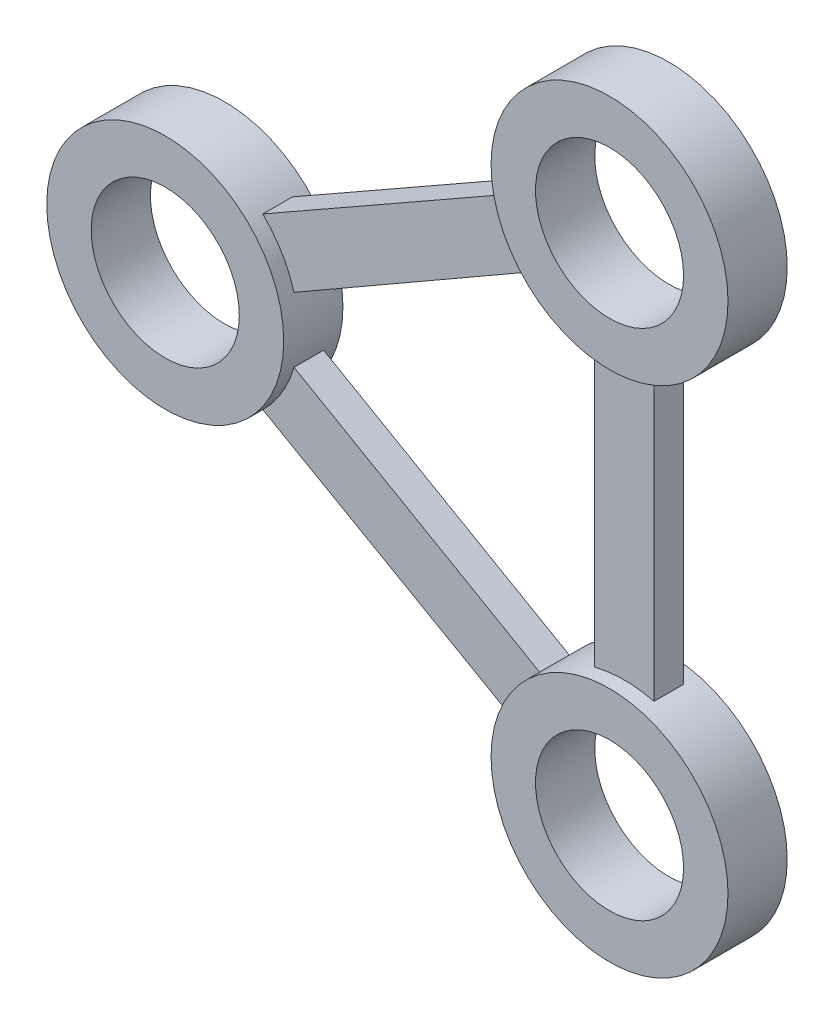
from build123d import *

# Parameters (mm, degrees)
BOSS_EXTRUDE1_DEPTH        = 5
BOSS_EXTRUDE1_DEPTH_BACK   = 5
BOSS_EXTRUDE1_2_DEPTH      = 5
BOSS_EXTRUDE1_2_DEPTH_BACK = 5
BOSS_EXTRUDE1_3_DEPTH      = 5
BOSS_EXTRUDE1_3_DEPTH_BACK = 5
BOSS_EXTRUDE2_DEPTH        = 10
BOSS_EXTRUDE2_DEPTH_BACK   = 10
SKETCH1_6_R                = 40
SKETCH1_6_R_2              = 25


with BuildPart() as part:
    # Sketch1 → Boss-Extrude1 (new, two sides: drawn at the far end of the back side and taken through both)
    with BuildSketch(Plane.XY.offset(-BOSS_EXTRUDE1_DEPTH_BACK)):
        with BuildLine():
            Line((10, 47.870166538), (10, -47.870166538))
            ThreePointArc((10, -47.870166538), (0, -46.6), (-10, -47.870166538))
            Line((-10, -47.870166538), (-10, 47.870166538))
            ThreePointArc((-10, 47.870166538), (0, 46.6), (10, 47.870166538))
        make_face()
    extrude(amount=BOSS_EXTRUDE1_DEPTH + BOSS_EXTRUDE1_DEPTH_BACK)



with BuildPart() as body_2:
    # Sketch1 → Boss-Extrude1 2 (new, two sides: drawn at the far end of the back side and taken through both)
    with BuildSketch(Plane.XY.offset(-BOSS_EXTRUDE1_2_DEPTH_BACK)):
        with BuildLine():
            Line((-122.049730922, 28.614375032), (-38.604515092, 76.126633087))
            ThreePointArc((-38.604515092, 76.126633087), (-34.719424314, 66.736425918), (-28.593413405, 58.628287327))
            Line((-28.593413405, 58.628287327), (-111.528626884, 10.952326263))
            ThreePointArc((-111.528626884, 10.952326263), (-115.635110511, 20.470817531), (-122.049730922, 28.614375032))
        make_face()
    extrude(amount=BOSS_EXTRUDE1_2_DEPTH + BOSS_EXTRUDE1_2_DEPTH_BACK)


with BuildPart() as body_3:
    # Sketch1 → Boss-Extrude1 3 (new, two sides: drawn at the far end of the back side and taken through both)
    with BuildSketch(Plane.XY.offset(-BOSS_EXTRUDE1_3_DEPTH_BACK)):
        with BuildLine():
            Line((-111.528626884, -10.952326263), (-28.593413405, -58.628287327))
            ThreePointArc((-28.593413405, -58.628287327), (-34.719424235, -66.736425963), (-38.604515092, -76.126633087))
            Line((-38.604515092, -76.126633087), (-122.049730922, -28.614375032))
            ThreePointArc((-122.049730922, -28.614375032), (-115.635110511, -20.470817531), (-111.528626884, -10.952326263))
        make_face()
    extrude(amount=BOSS_EXTRUDE1_3_DEPTH + BOSS_EXTRUDE1_3_DEPTH_BACK)


with BuildPart() as part_1:
    add(part.part)

    add(body_2.part)  # Boss-Extrude2 merges body 2

    add(body_3.part)  # Boss-Extrude2 merges body 3
    # Sketch1<6> → Boss-Extrude2 (add, two sides: drawn at the far end of the back side and taken through both)
    # profile 1 of 3: a face of its own
    with BuildSketch(Plane.XY.offset(-BOSS_EXTRUDE2_DEPTH_BACK)):
        with Locations((0, 86.6)):
            Circle(SKETCH1_6_R)
        with Locations((0, 86.6)):
            Circle(SKETCH1_6_R_2, mode=Mode.SUBTRACT)
    # profile 2 of 3: a face of its own
    with BuildSketch(Plane.XY.offset(-BOSS_EXTRUDE2_DEPTH_BACK)):
        with Locations((0, -86.6)):
            Circle(SKETCH1_6_R)
        with Locations((0, -86.6)):
            Circle(SKETCH1_6_R_2, mode=Mode.SUBTRACT)
    # profile 3 of 3: a face of its own
    with BuildSketch(Plane.XY.offset(-BOSS_EXTRUDE2_DEPTH_BACK)):
        with Locations((-150, 0)):
            Circle(SKETCH1_6_R)
        with Locations((-150, 0)):
            Circle(SKETCH1_6_R_2, mode=Mode.SUBTRACT)
    extrude(amount=BOSS_EXTRUDE2_DEPTH + BOSS_EXTRUDE2_DEPTH_BACK)


solid = part_1.part
